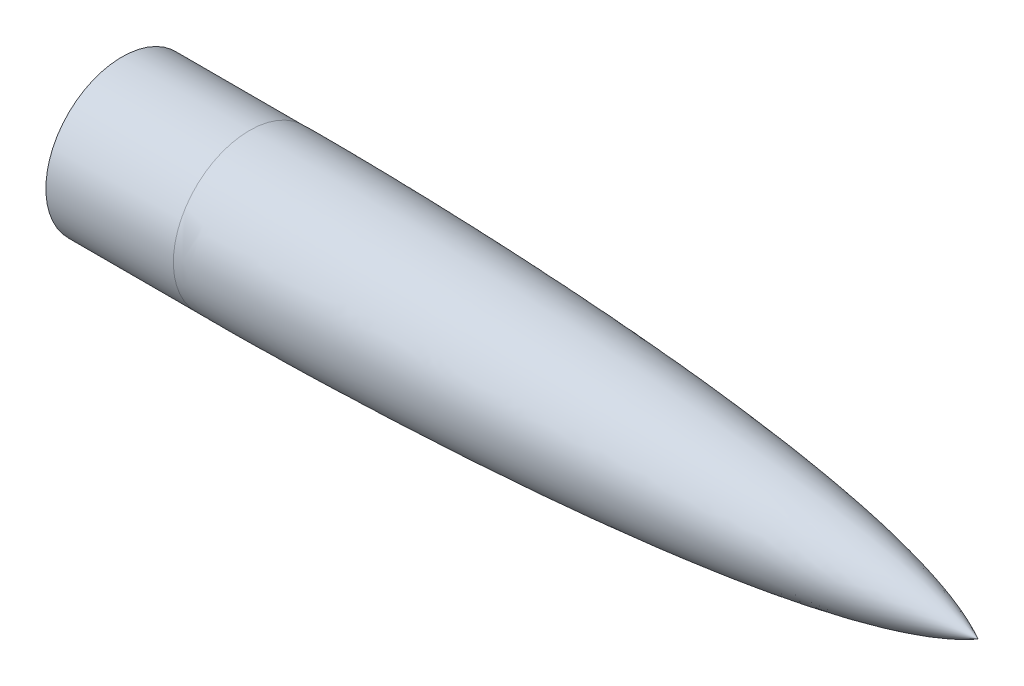
from build123d import *


with BuildPart() as part:
    # Sketch3 → Revolve2 (revolve)
    with BuildSketch(Plane.XY, mode=Mode.PRIVATE) as revolve2_sk:
        with BuildLine():
            Line((200, 0), (192.731748763, 0))
            Line((192.731748763, 0), (188.748865911, 0))
            Line((188.748865911, 0), (185.554968391, 0))
            ThreePointArc((185.554968391, 0), (185.198240806, 1.091085504), (184.265857104, 1.760699406))
            add(Edge.make_bspline(
                [(178.137279994, 3.383612476), (178.431880321, 3.311777357), (179.017417539, 3.167412546), (180.511240953, 2.790775813), (182.135744265, 2.361389471), (183.568791854, 1.960792453), (184.132740627, 1.79909771), (184.265857104, 1.760699406)],
                knots=[0.85993918, 0.85993918, 0.85993918, 0.85993918, 0.864852403, 0.869765625, 0.885330346, 0.893241051, 0.895697662, 0.895697662, 0.895697662, 0.895697662], degree=3))
            Line((178.137279994, 3.383612476), (147.7296017, 9.894790998))
            add(Edge.make_bspline(
                [(41.778806091, 17.377756502), (42.888675735, 17.34735616), (45.382334629, 17.276459751), (52.543154013, 17.055733908), (63.714970652, 16.647846743), (79.045577049, 15.93167668), (94.844842448, 15.005975037), (110.790774364, 13.846638116), (126.094444394, 12.471683292), (137.111316028, 11.257513206), (144.087385917, 10.382317987), (146.522210313, 10.059467354), (147.7296017, 9.894790998)],
                knots=[0.277813546, 0.277813546, 0.277813546, 0.277813546, 0.293438546, 0.3125, 0.375, 0.4375, 0.5, 0.5625, 0.625, 0.681957494, 0.697582494, 0.713207494, 0.713207494, 0.713207494, 0.713207494], degree=3))
            Line((41.778806091, 17.377756502), (0, 19.3))
            Line((0, 19.3), (-35, 19.3))
            Line((-35, 19.3), (-35, 20.899900489))
            Line((-35, 20.899900489), (0, 20.899900489))
            add(Edge.make_bspline(
                [(0, 20.899900489), (23.664847852, 21.163845658), (163.177563929, 19.764416347), (200, 0)],
                knots=[0, 0, 0, 0, 1, 1, 1, 1], degree=3))
        make_face()
    revolve(revolve2_sk.sketch.rotate(Axis((0, 0, 0), (-1, 0, 0)), 90), axis=Axis((0, 0, 0), (-1, 0, 0)))


solid = part.part
